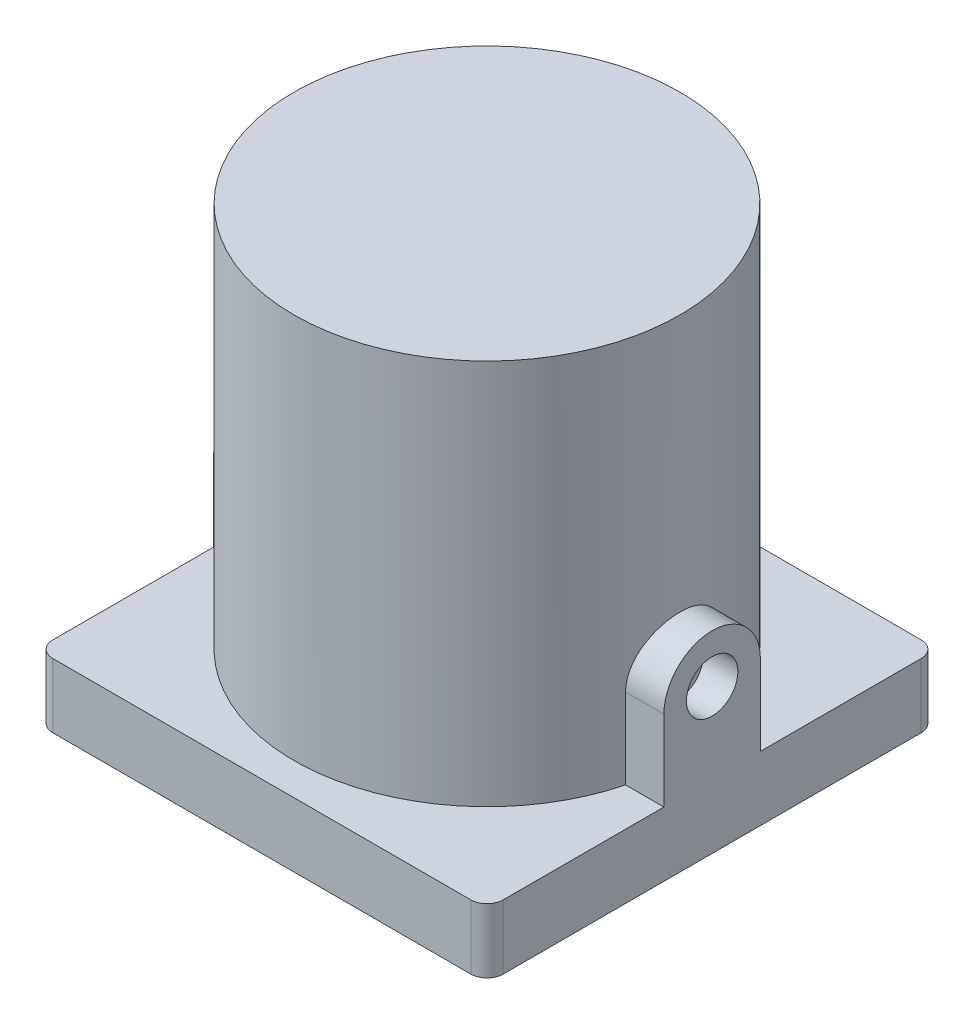
from build123d import *

# Parameters (mm, degrees)
BOSS_EXTRUDE1_DEPTH = 2
BOSS_EXTRUDE2_DEPTH = 14
SKETCH3_R           = 0.8
CUT_EXTRUDE1_DEPTH  = 17.763054614
SKETCH4_R           = 6
BOSS_EXTRUDE3_DEPTH = 12


with BuildPart() as part:
    # Sketch1 → Boss-Extrude1 (new body)
    with BuildSketch(Plane(origin=(0, 0, 0), x_dir=(1, 0, 0), z_dir=(0, 1, 0))):
        with BuildLine():
            Line((-6.5, 7), (6.5, 7))
            ThreePointArc((6.5, 7), (6.853553391, 6.853553391), (7, 6.5))
            Line((7, 6.5), (7, -6.5))
            ThreePointArc((7, -6.5), (6.853553391, -6.853553391), (6.5, -7))
            Line((6.5, -7), (-6.5, -7))
            ThreePointArc((-6.5, -7), (-6.853553391, -6.853553391), (-7, -6.5))
            Line((-7, -6.5), (-7, 6.5))
            ThreePointArc((-7, 6.5), (-6.853553391, 6.853553391), (-6.5, 7))
        make_face()
    extrude(amount=BOSS_EXTRUDE1_DEPTH)

    # Sketch2 → Boss-Extrude2 (add, through all)
    with BuildSketch(Plane.ZY.offset(7)):
        with BuildLine():
            Line((-1.5, 4.5), (-1.5, 2))
            Line((-1.5, 2), (1.5, 2))
            Line((1.5, 2), (1.5, 4.5))
            ThreePointArc((1.5, 4.5), (0, 6), (-1.5, 4.5))
        make_face()
    extrude(amount=-BOSS_EXTRUDE2_DEPTH)

    # Sketch3 → Cut-Extrude1 (cut, through all)
    with BuildSketch(Plane.ZY.offset(7)):
        with Locations((0, 4.5)):
            Circle(SKETCH3_R)
    extrude(amount=-CUT_EXTRUDE1_DEPTH, mode=Mode.SUBTRACT)

    # Sketch4 → Boss-Extrude3 (add)
    with BuildSketch(Plane(origin=(0, 2, 0), x_dir=(1, 0, 0), z_dir=(0, 1, 0))):
        with Locations(Location((0, 0, 0), (0, 0, 165.522487814))):
            Circle(SKETCH4_R)
    extrude(amount=BOSS_EXTRUDE3_DEPTH)


solid = part.part
